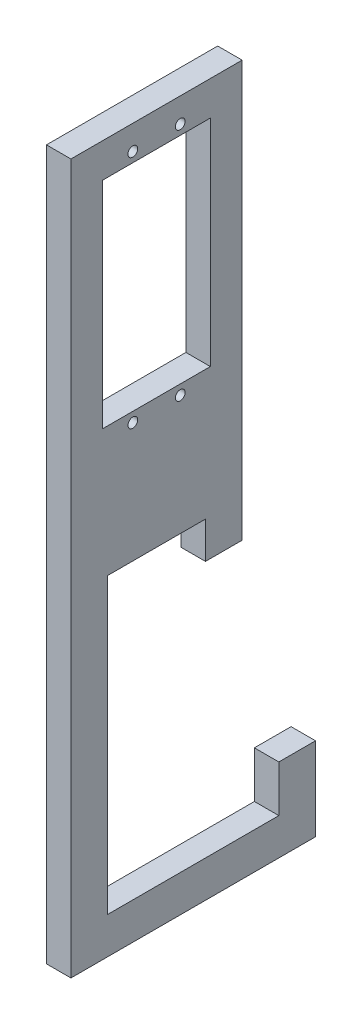
from build123d import *

# Parameters (mm, degrees)
SKETCH1_W           = 35
SKETCH1_H           = 70
SKETCH1_R           = 1
SKETCH1_W_2         = 22
SKETCH1_H_2         = 44
BOSS_EXTRUDE1_DEPTH = 2.5
BOSS_EXTRUDE2_START = -2.5
BOSS_EXTRUDE2_DEPTH = 5


with BuildPart() as part:
    # Sketch1 → Boss-Extrude1 (new, symmetric)
    with BuildSketch(Plane(origin=(0, 0, 0), x_dir=(0, 0, -1), z_dir=(1, 0, 0))):
        with Locations((0, -6)):
            Rectangle(SKETCH1_W, SKETCH1_H)
        with Locations((-4.85, -24)):
            Circle(SKETCH1_R, mode=Mode.SUBTRACT)
        with Locations((4.85, -24)):
            Circle(SKETCH1_R, mode=Mode.SUBTRACT)
        with Locations((4.85, 24)):
            Circle(SKETCH1_R, mode=Mode.SUBTRACT)
        with Locations((-4.85, 24)):
            Circle(SKETCH1_R, mode=Mode.SUBTRACT)
        Rectangle(SKETCH1_W_2, SKETCH1_H_2, mode=Mode.SUBTRACT)
    extrude(amount=BOSS_EXTRUDE1_DEPTH, both=True)

    # Sketch2 → Boss-Extrude2 (add)
    with BuildSketch(Plane(origin=(0, 0, 0), x_dir=(0, 0, -1), z_dir=(1, 0, 0)).offset(BOSS_EXTRUDE2_START)):
        Polygon((17.5, -41), (17.5, -56), (10, -56), (10, -48.5), (-10, -48.5), (-10, -108.5), (25, -108.5), (25, -99), (32.5, -99), (32.5, -116), (-17.5, -116), (-17.5, -41), align=None)
    extrude(amount=BOSS_EXTRUDE2_DEPTH)


solid = part.part
